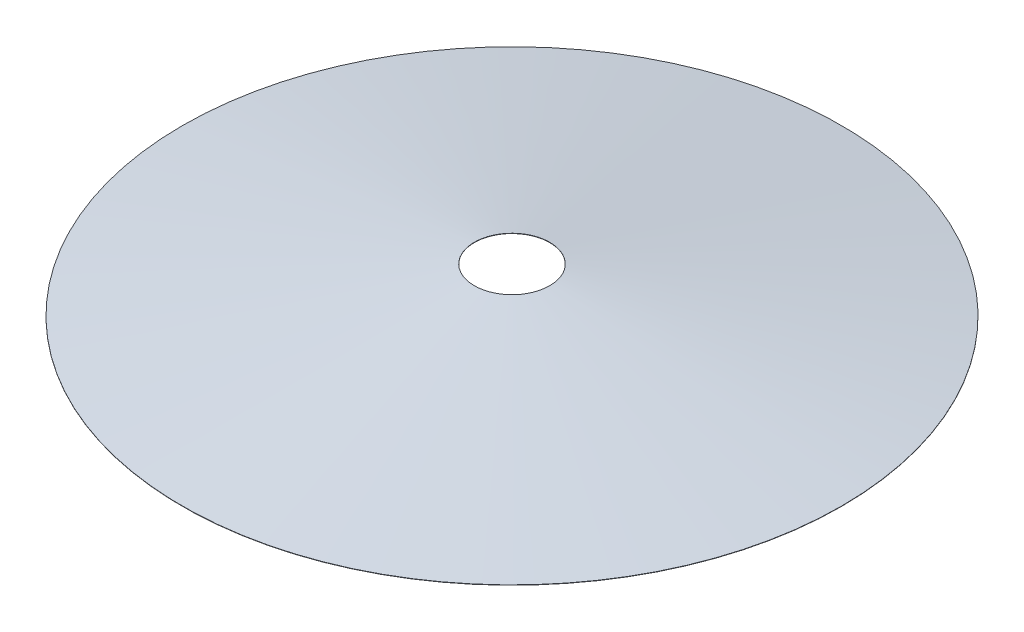
from build123d import *

# Parameters (mm, degrees)
CUT_EXTRUDE1_DEPTH      = 6215.801042672
CUT_EXTRUDE1_DEPTH_BACK = 6215.801042672
SKETCH2_R               = 500


with BuildPart() as part:
    # Sketch1 → Revolve1 (revolve)
    with BuildSketch(Plane.XY, mode=Mode.PRIVATE) as revolve1_sk:
        Polygon((-4374, 204), (-4374, 200), (-500, 796), (0, 796), (0, 800), (-500, 800), align=None)
    revolve(revolve1_sk.sketch.rotate(Axis((0, 796, 0), (0, -1, 0)), 180), axis=Axis((0, 796, 0), (0, -1, 0)))

    # Sketch2 → Cut-Extrude1 (cut, two sides: drawn at the far end of the back side and taken through both)
    with BuildSketch(Plane(origin=(0, 800, 0), x_dir=(1, 0, 0), z_dir=(0, 1, 0)).offset(-CUT_EXTRUDE1_DEPTH_BACK)):
        Circle(SKETCH2_R)
    extrude(amount=CUT_EXTRUDE1_DEPTH + CUT_EXTRUDE1_DEPTH_BACK, mode=Mode.SUBTRACT)


solid = part.part
